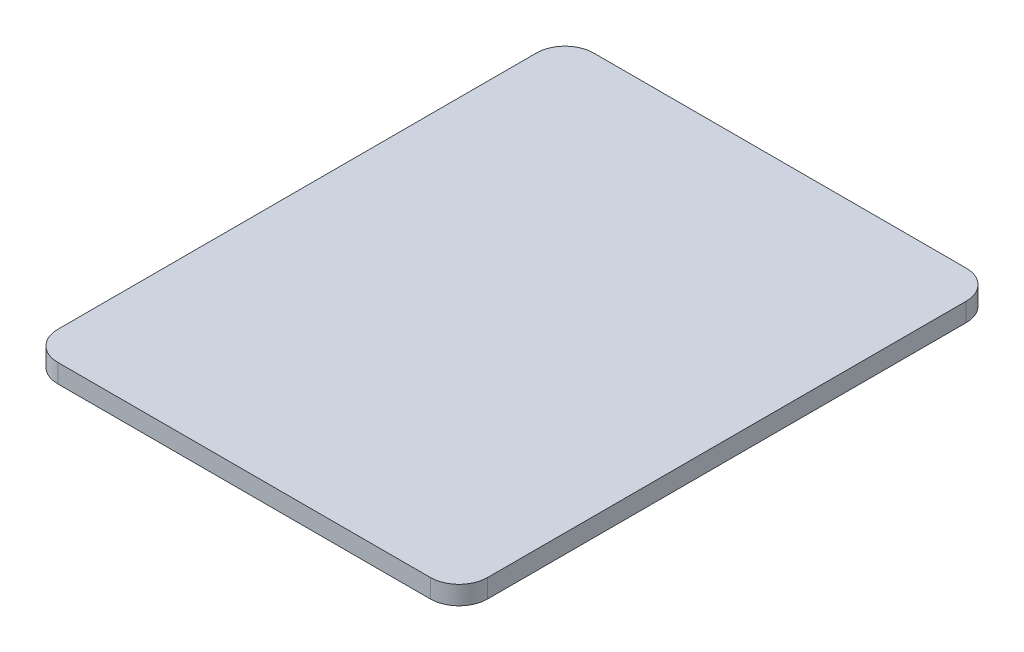
from build123d import *

# Parameters (mm, degrees)
SKETCH_1_W      = 30
SKETCH_1_H      = 37.4
EXTRUDE_1_DEPTH = 1.3
FILLET_1_R      = 2


with BuildPart() as part:
    # 草图1 → 凸台-拉伸1 (new body)
    with BuildSketch(Plane(origin=(0, 0, 0), x_dir=(1, 0, 0), z_dir=(0, 1, 0))):
        Rectangle(SKETCH_1_W, SKETCH_1_H)
    extrude(amount=EXTRUDE_1_DEPTH)

    # 圆角1
    fillet_1_edges = [part.edges().sort_by_distance(p)[0] for p in [
        (15, 0.65, 18.7),
        (-15, 0.65, 18.7),
        (-15, 0.65, -18.7),
        (15, 0.65, -18.7),
    ]]
    fillet(fillet_1_edges, radius=FILLET_1_R)


solid = part.part
